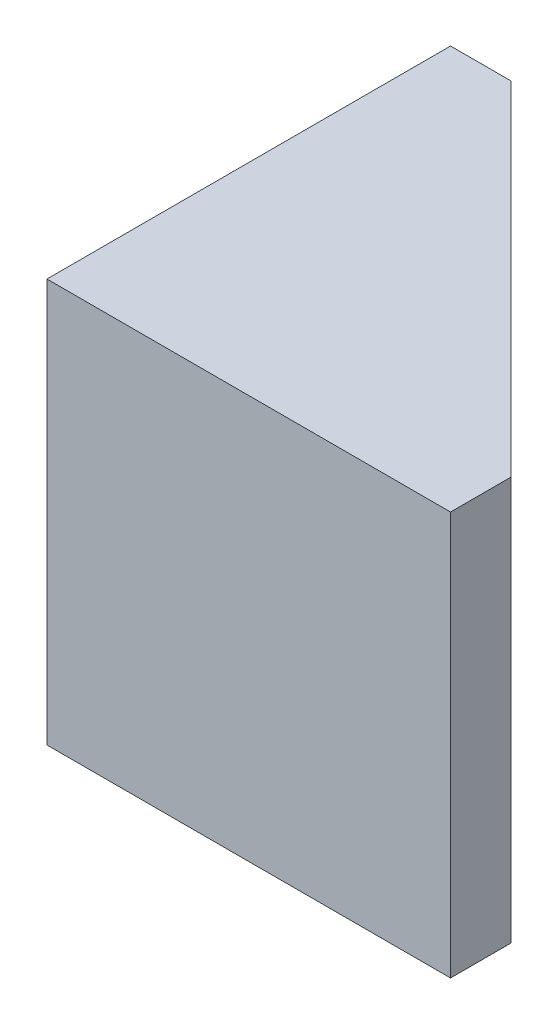
from build123d import *

# Parameters (mm, degrees)
EXTRUDE_1_DEPTH = 10
EXTRUDE_START   = -10
EXTRUDE_2_DEPTH = 3


with BuildPart() as part:
    # Эскиз1 → Бобышка-Вытянуть1 (new, symmetric)
    with BuildSketch(Plane(origin=(0, 0, 0), x_dir=(1, 0, 0), z_dir=(0, 1, 0))):
        Polygon((0, 20), (0, 0), (20, 0), (20, 3), (3, 3), (3, 20), align=None)
    extrude(amount=EXTRUDE_1_DEPTH, both=True)

    # Эскиз1<3> → Бобышка-Вытянуть2 (add)
    with BuildSketch(Plane(origin=(0, 0, 0), x_dir=(1, 0, 0), z_dir=(0, 1, 0)).offset(EXTRUDE_START)):
        Polygon((20, 3), (3, 20), (3, 3), align=None)
    extrude_2 = extrude(amount=EXTRUDE_2_DEPTH)

    # Зеркальное отражение2: Бобышка-Вытянуть2 across plane
    add(extrude_2.mirror(Plane.ZX))


solid = part.part
